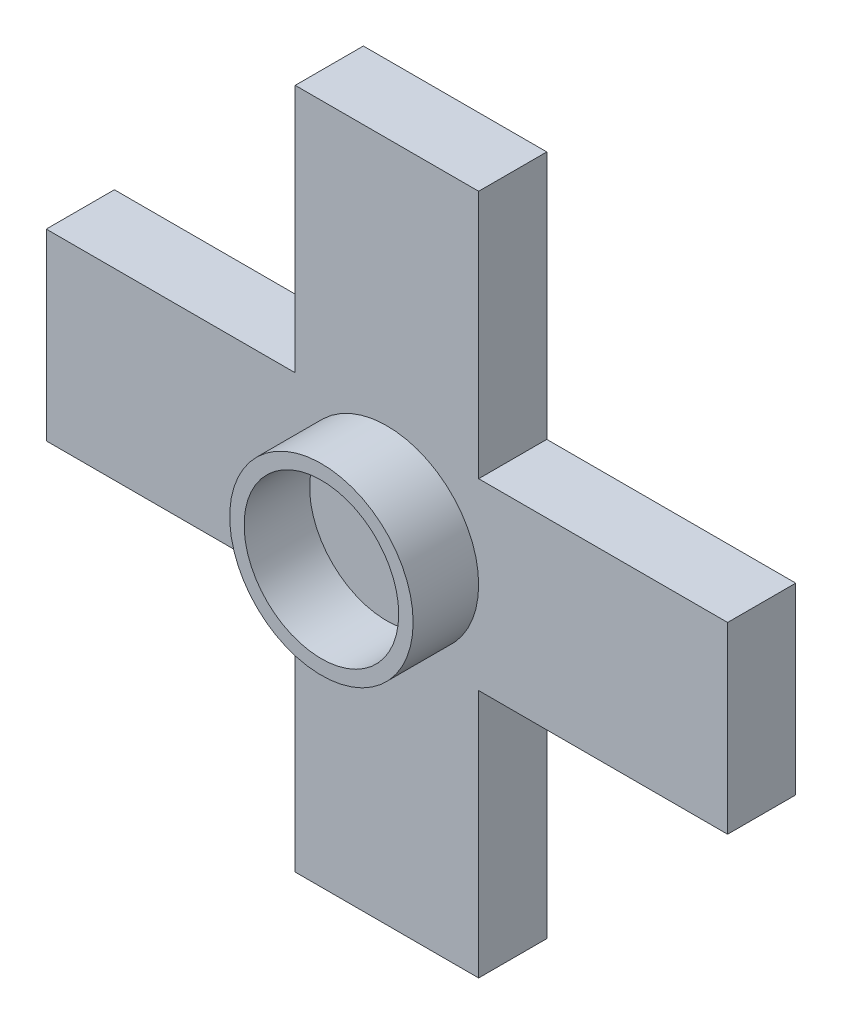
from build123d import *

# Parameters (mm, degrees)
EXTRUDE_1_DEPTH = 2.6
SKETCH_2_R      = 3.5
SKETCH_2_R_2    = 2.95
EXTRUDE_2_DEPTH = 2.5


with BuildPart() as part:
    # ｽｹｯﾁ1 → ﾎﾞｽ - 押し出し1 (new body)
    with BuildSketch(Plane.XY):
        Polygon((11.29842378, 0.078571429), (20.79842378, 0.078571429), (20.79842378, 9.578571429), (27.79842378, 9.578571429), (27.79842378, 0.078571429), (37.29842378, 0.078571429), (37.29842378, -6.921428571), (27.79842378, -6.921428571), (27.79842378, -16.421428571), (20.79842378, -16.421428571), (20.79842378, -6.921428571), (11.29842378, -6.921428571), align=None)
    extrude(amount=EXTRUDE_1_DEPTH)

    # ｽｹｯﾁ2 → ﾎﾞｽ - 押し出し2 (add)
    with BuildSketch(Plane.XY.offset(2.6)):
        with Locations((24.29842378, -3.421428571)):
            Circle(SKETCH_2_R)
        with Locations((24.29842378, -3.421428571)):
            Circle(SKETCH_2_R_2, mode=Mode.SUBTRACT)
    extrude(amount=EXTRUDE_2_DEPTH)


solid = part.part
